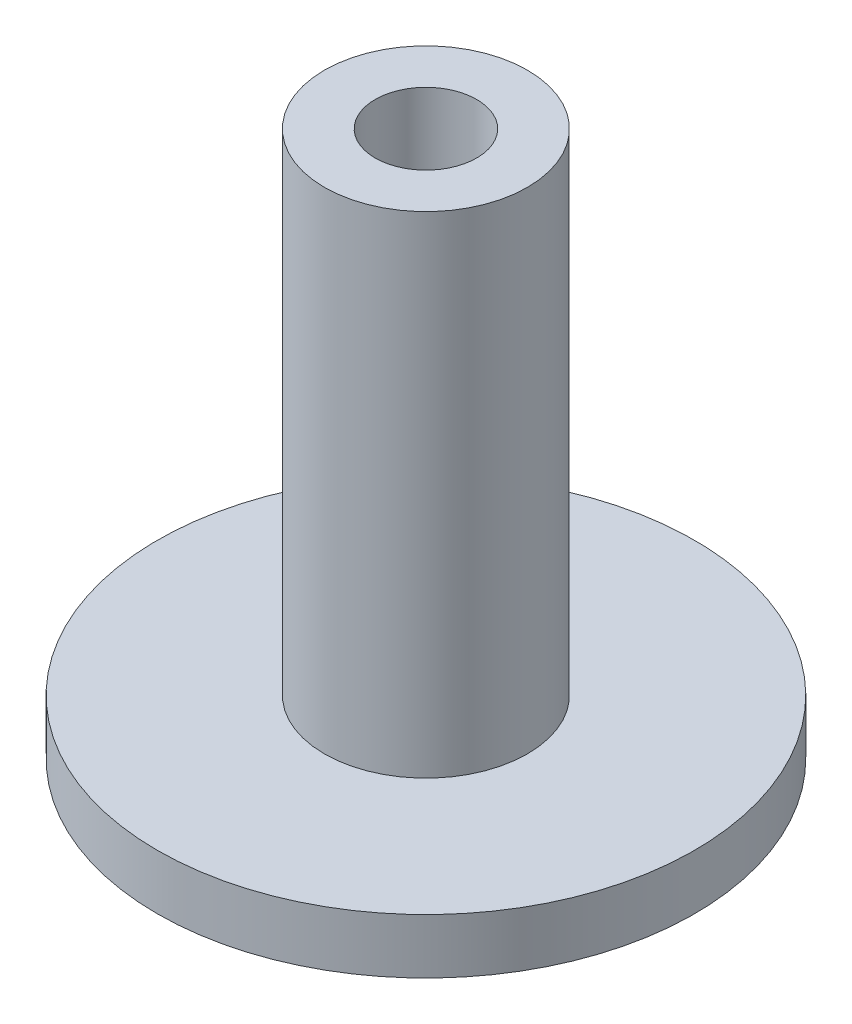
from build123d import *

# Parameters (mm, degrees)
SKETCH1_R           = 6.35
BOSS_EXTRUDE1_DEPTH = 1.3
SKETCH2_R           = 2.4
BOSS_EXTRUDE2_DEPTH = 11.6
SKETCH3_R           = 1.2
CUT_EXTRUDE1_DEPTH  = 16.717983331


with BuildPart() as part:
    # Sketch1 → Boss-Extrude1 (new body)
    with BuildSketch(Plane(origin=(0, 0, 0), x_dir=(1, 0, 0), z_dir=(0, 1, 0))):
        with Locations(Location((0, 0, 0), (0, 0, 270))):
            Circle(SKETCH1_R)
    extrude(amount=BOSS_EXTRUDE1_DEPTH)

    # Sketch2 → Boss-Extrude2 (add)
    with BuildSketch(Plane(origin=(0, 1.3, 0), x_dir=(1, 0, 0), z_dir=(0, 1, 0))):
        with Locations(Location((0, 0, 0), (0, 0, 270))):
            Circle(SKETCH2_R)
    extrude(amount=BOSS_EXTRUDE2_DEPTH)

    # Sketch3 → Cut-Extrude1 (cut, through all)
    with BuildSketch(Plane(origin=(0, 12.9, 0), x_dir=(1, 0, 0), z_dir=(0, 1, 0))):
        with Locations(Location((0, 0, 0), (0, 0, 270))):
            Circle(SKETCH3_R)
    extrude(amount=-CUT_EXTRUDE1_DEPTH, mode=Mode.SUBTRACT)


solid = part.part
